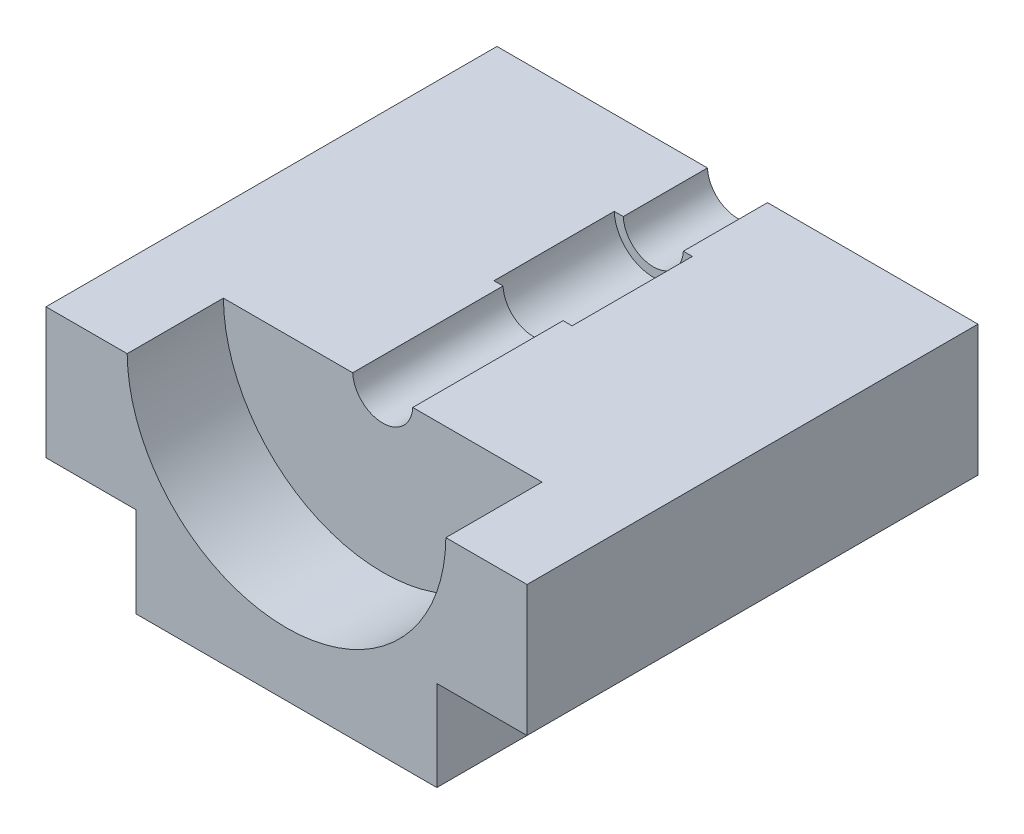
from build123d import *

# Parameters (mm, degrees)
BOSS_EXTRUDE1_DEPTH     = 8
SKETCH3_R               = 13.75
CUT_EXTRUDE1_DEPTH      = 8
SKETCH4_W               = 80
SKETCH4_H               = 37
BOSS_EXTRUDE2_DEPTH     = 75
SKETCH5_R               = 26.5
CUT_EXTRUDE2_DEPTH      = 16
SKETCH6_R               = 6.5
CUT_EXTRUDE3_DEPTH      = 75
BOSS_EXTRUDE3_START     = 16
BOSS_EXTRUDE3_DEPTH     = 25
BOSS_EXTRUDE4_START     = 61
BOSS_EXTRUDE4_DEPTH     = 14
SKETCH10_W              = 150
SKETCH10_H              = 175
CUT_EXTRUDE4_DEPTH      = 8
CUT_EXTRUDE5_DEPTH      = 103.342562016
CUT_EXTRUDE5_DEPTH_BACK = 103.342562016
SKETCH12_W              = 80
SKETCH12_H              = 0.25
SKETCH13_W              = 15
SKETCH13_H              = 15
CUT_EXTRUDE6_DEPTH      = 75


with BuildPart() as part:
    # Sketch2 → Boss-Extrude1 (new body)
    with BuildSketch(Plane.XY):
        with BuildLine():
            Line((-35, 60), (-35, 50))
            ThreePointArc((-35, 50), (-37.196699141, 44.696699141), (-42.5, 42.5))
            Line((-42.5, 42.5), (-52.5, 42.5))
            ThreePointArc((-52.5, 42.5), (-57.803300859, 40.303300859), (-60, 35))
            Line((-60, 35), (-60, -60))
            ThreePointArc((-60, -60), (-57.803300859, -65.303300859), (-52.5, -67.5))
            Line((-52.5, -67.5), (52.5, -67.5))
            ThreePointArc((52.5, -67.5), (57.803300859, -65.303300859), (60, -60))
            Line((60, -60), (60, 35))
            ThreePointArc((60, 35), (57.803300859, 40.303300859), (52.5, 42.5))
            Line((52.5, 42.5), (42.5, 42.5))
            ThreePointArc((42.5, 42.5), (37.196699141, 44.696699141), (35, 50))
            Line((35, 50), (35, 60))
            ThreePointArc((35, 60), (32.803300859, 65.303300859), (27.5, 67.5))
            Line((27.5, 67.5), (-27.5, 67.5))
            ThreePointArc((-27.5, 67.5), (-32.803300859, 65.303300859), (-35, 60))
        make_face()
    extrude(amount=-BOSS_EXTRUDE1_DEPTH)

    # Sketch3 → Cut-Extrude1 (cut)
    with BuildSketch(Plane.XY):
        with Locations((0, -20)):
            Circle(SKETCH3_R)
    extrude(amount=-CUT_EXTRUDE1_DEPTH, mode=Mode.SUBTRACT)

    # Sketch4 → Boss-Extrude2 (add)
    with BuildSketch(Plane(origin=(0, 0, -8), x_dir=(-1, 0, 0), z_dir=(0, 0, -1))):
        with Locations((0, -38.5)):
            Rectangle(SKETCH4_W, SKETCH4_H)
    extrude(amount=BOSS_EXTRUDE2_DEPTH)

    # Sketch5 → Cut-Extrude2 (cut)
    with BuildSketch(Plane(origin=(0, 0, -8), x_dir=(-1, 0, 0), z_dir=(0, 0, -1))):
        with Locations((0, -20)):
            Circle(SKETCH5_R)
    extrude(amount=CUT_EXTRUDE2_DEPTH, mode=Mode.SUBTRACT)

    # Sketch6 → Cut-Extrude3 (cut)
    with BuildSketch(Plane(origin=(0, 0, -8), x_dir=(-1, 0, 0), z_dir=(0, 0, -1))):
        with Locations((0, -20)):
            Circle(SKETCH6_R)
    extrude(amount=CUT_EXTRUDE3_DEPTH, mode=Mode.SUBTRACT)

    # Sketch8 → Boss-Extrude3 (add)
    with BuildSketch(Plane(origin=(0, 0, -8), x_dir=(-1, 0, 0), z_dir=(0, 0, -1)).offset(BOSS_EXTRUDE3_START)):
        with BuildLine():
            Line((-6.5, -20), (-5, -20))
            ThreePointArc((-5, -20), (0, -25), (5, -20))
            Line((5, -20), (6.5, -20))
            ThreePointArc((6.5, -20), (0, -26.5), (-6.5, -20))
        make_face()
    extrude(amount=BOSS_EXTRUDE3_DEPTH)

    # Sketch9 → Boss-Extrude4 (add)
    with BuildSketch(Plane(origin=(0, 0, -8), x_dir=(-1, 0, 0), z_dir=(0, 0, -1)).offset(BOSS_EXTRUDE4_START)):
        with BuildLine():
            Line((-6.5, -20), (-5, -20))
            ThreePointArc((-5, -20), (0, -25), (5, -20))
            Line((5, -20), (6.5, -20))
            ThreePointArc((6.5, -20), (0, -26.5), (-6.5, -20))
        make_face()
    extrude(amount=BOSS_EXTRUDE4_DEPTH)

    # Sketch10 → Cut-Extrude4 (cut)
    with BuildSketch(Plane.XY):
        Rectangle(SKETCH10_W, SKETCH10_H)
    extrude(amount=-CUT_EXTRUDE4_DEPTH, mode=Mode.SUBTRACT)

    # Sketch12 → Cut-Extrude5 (cut, two sides: drawn at the far end of the back side and taken through both)
    with BuildSketch(Plane.XY.offset(-8).offset(-CUT_EXTRUDE5_DEPTH_BACK)):
        with Locations((0, -20.125)):
            Rectangle(SKETCH12_W, SKETCH12_H)
    extrude(amount=CUT_EXTRUDE5_DEPTH + CUT_EXTRUDE5_DEPTH_BACK, mode=Mode.SUBTRACT)

    # Sketch13 → Cut-Extrude6 (cut)
    with BuildSketch(Plane(origin=(0, 0, -83), x_dir=(-1, 0, 0), z_dir=(0, 0, -1))):
        with Locations((32.5, -49.5)):
            Rectangle(SKETCH13_W, SKETCH13_H)
        with Locations((-32.5, -49.5)):
            Rectangle(SKETCH13_W, SKETCH13_H)
    extrude(amount=-CUT_EXTRUDE6_DEPTH, mode=Mode.SUBTRACT)


solid = part.part
